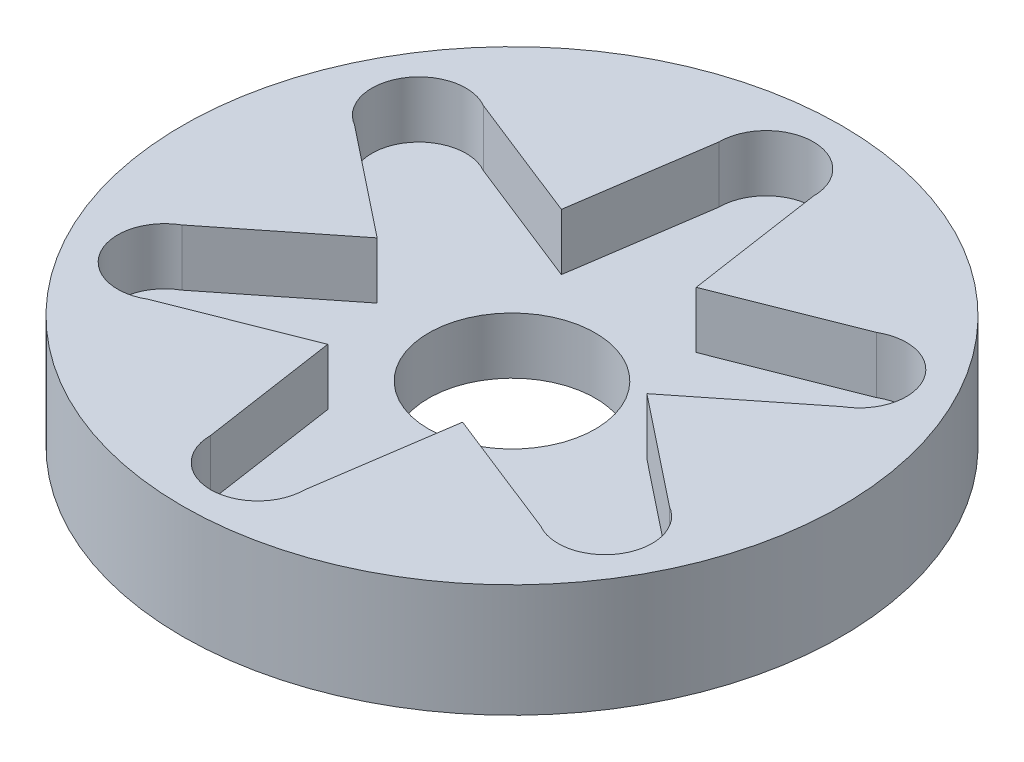
from build123d import *

# Parameters (mm, degrees)
SKETCH1_R           = 17.5
BOSS_EXTRUDE3_DEPTH = 6
SKETCH1_11_R        = 4.425
BOSS_EXTRUDE5_DEPTH = 3


with BuildPart() as part:
    # Sketch1 → Boss-Extrude3 (new body)
    with BuildSketch(Plane(origin=(0, 0, 0), x_dir=(1, 0, 0), z_dir=(0, 1, 0))):
        Circle(SKETCH1_R)
        with BuildLine():
            ThreePointArc((-2.5, 13.5), (-1.767766953, 15.267766953), (0, 16))
            ThreePointArc((0, 16), (1.767766953, 15.267766953), (2.5, 13.5))
            Line((2.5, 13.5), (3.581091494, 6.202632414))
            Line((3.581091494, 6.202632414), (10.441342951, 8.915063509))
            ThreePointArc((10.441342951, 8.915063509), (12.338390564, 9.164814566), (13.856406461, 8))
            ThreePointArc((13.856406461, 8), (14.106157517, 7.397047613), (14.191342951, 6.75))
            ThreePointArc((14.191342951, 6.75), (13.856406461, 5.5), (12.941342951, 4.584936491))
            Line((12.941342951, 4.584936491), (7.162182988, 0))
            Line((7.162182988, 0), (12.941342951, -4.584936491))
            ThreePointArc((12.941342951, -4.584936491), (13.856406461, -5.5), (14.191342951, -6.75))
            ThreePointArc((14.191342951, -6.75), (14.106157517, -7.397047613), (13.856406461, -8))
            ThreePointArc((13.856406461, -8), (12.338390564, -9.164814566), (10.441342951, -8.915063509))
            Line((10.441342951, -8.915063509), (3.581091494, -6.202632414))
            Line((3.581091494, -6.202632414), (2.5, -13.5))
            ThreePointArc((2.5, -13.5), (1.767766953, -15.267766953), (0, -16))
            ThreePointArc((0, -16), (-1.767766953, -15.267766953), (-2.5, -13.5))
            Line((-2.5, -13.5), (-3.581091494, -6.202632414))
            Line((-3.581091494, -6.202632414), (-10.441342951, -8.915063509))
            ThreePointArc((-10.441342951, -8.915063509), (-12.338390564, -9.164814566), (-13.856406461, -8))
            ThreePointArc((-13.856406461, -8), (-14.106157517, -6.102952387), (-12.941342951, -4.584936491))
            Line((-12.941342951, -4.584936491), (-7.162182988, 0))
            Line((-7.162182988, 0), (-12.941342951, 4.584936491))
            ThreePointArc((-12.941342951, 4.584936491), (-14.106157517, 6.102952387), (-13.856406461, 8))
            ThreePointArc((-13.856406461, 8), (-12.338390564, 9.164814566), (-10.441342951, 8.915063509))
            Line((-10.441342951, 8.915063509), (-3.581091494, 6.202632414))
            Line((-3.581091494, 6.202632414), (-2.5, 13.5))
        make_face(mode=Mode.SUBTRACT)
    extrude(amount=BOSS_EXTRUDE3_DEPTH)

    # Sketch1<11> → Boss-Extrude5 (add)
    with BuildSketch(Plane(origin=(0, 0, 0), x_dir=(1, 0, 0), z_dir=(0, 1, 0))):
        with BuildLine():
            Line((-2.5, 13.5), (-3.581091494, 6.202632414))
            Line((-3.581091494, 6.202632414), (-10.441342951, 8.915063509))
            ThreePointArc((-10.441342951, 8.915063509), (-13.856406461, 8), (-12.941342951, 4.584936491))
            Line((-12.941342951, 4.584936491), (-7.162182988, 0))
            Line((-7.162182988, 0), (-12.941342951, -4.584936491))
            ThreePointArc((-12.941342951, -4.584936491), (-13.856406461, -8), (-10.441342951, -8.915063509))
            Line((-10.441342951, -8.915063509), (-3.581091494, -6.202632414))
            Line((-3.581091494, -6.202632414), (-2.5, -13.5))
            ThreePointArc((-2.5, -13.5), (0, -16), (2.5, -13.5))
            Line((2.5, -13.5), (3.581091494, -6.202632414))
            Line((3.581091494, -6.202632414), (10.441342951, -8.915063509))
            ThreePointArc((10.441342951, -8.915063509), (13.856406461, -8), (12.941342951, -4.584936491))
            Line((12.941342951, -4.584936491), (7.162182988, 0))
            Line((7.162182988, 0), (12.941342951, 4.584936491))
            ThreePointArc((12.941342951, 4.584936491), (13.856406461, 8), (10.441342951, 8.915063509))
            Line((10.441342951, 8.915063509), (3.581091494, 6.202632414))
            Line((3.581091494, 6.202632414), (2.5, 13.5))
            ThreePointArc((2.5, 13.5), (0, 16), (-2.5, 13.5))
        make_face()
        Circle(SKETCH1_11_R, mode=Mode.SUBTRACT)
    extrude(amount=BOSS_EXTRUDE5_DEPTH)


solid = part.part
